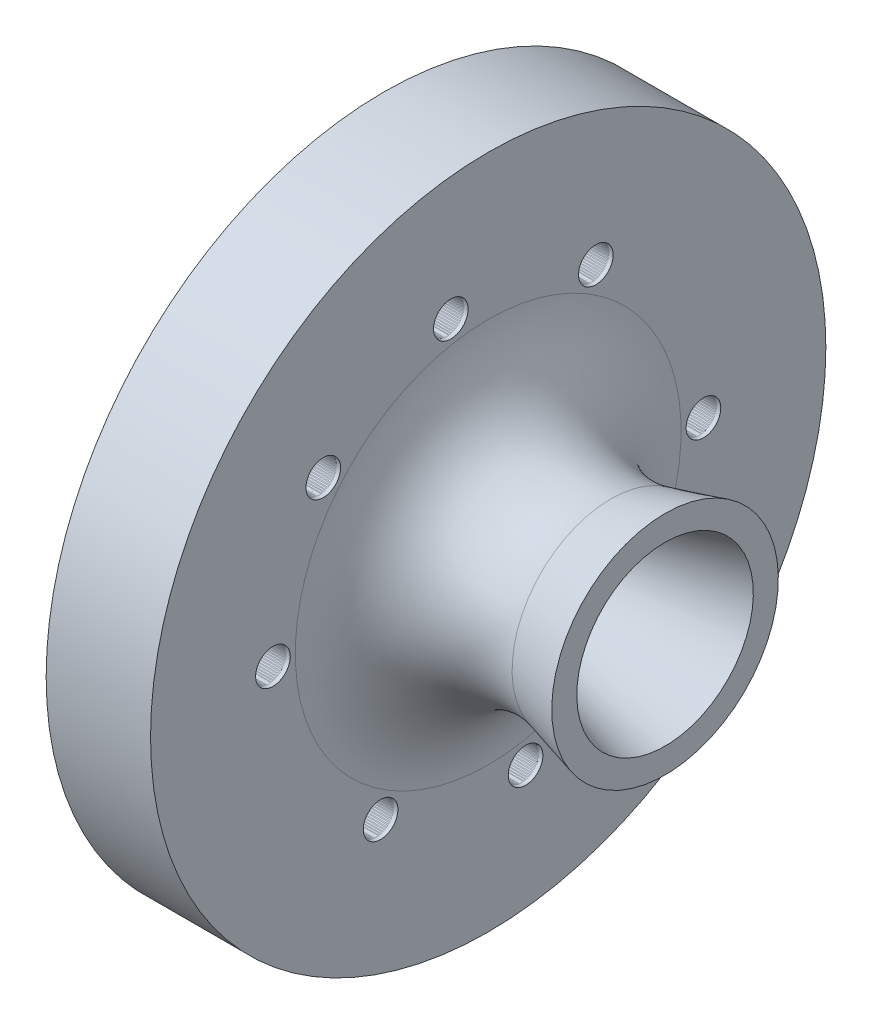
from build123d import *

# Parameters (mm, degrees)
SKETCH3_R           = 23.622
SKETCH3_R_2         = 10.6172
BOSS_EXTRUDE1_DEPTH = 4
CUT_EXTRUDE1_START  = -4.3942
SKETCH10_R          = 1.635
CUT_EXTRUDE1_DEPTH  = 9.8552
FILLET2_R           = 9.2
CUT_EXTRUDE2_DEPTH  = 1.27


with BuildPart() as part:
    # Sketch2 → Revolve1 (revolve)
    with BuildSketch(Plane.XY):
        Polygon((-4.3942, 4.3942), (0, 0), (16.696, 4.4732), (16.696, 6.8354), (0, 2.3622), (0, 28.0154), (-9.8552, 28.0154), (-9.8552, 11.9792), (-7.5692, 11.9792), (-7.5692, 10.7492), (-4.3942, 10.7492), (-4.3942, 8.8892), (-5.6896, 8.8892), (-5.6896, 6.7556), (-4.3942, 6.7564), align=None)
    revolve(axis=Axis((16.696, -3.8608, 0), (-1, 0, 0)))


with BuildPart() as body_2:
    # Sketch3 → Boss-Extrude1 (new body)
    with BuildSketch(Plane.ZY.offset(4.3942)):
        with Locations(Location((0, -3.8608, 0), (0, 0, 270))):
            Circle(SKETCH3_R)
        with Locations(Location((0, -3.8608, 0), (0, 0, 270))):
            Circle(SKETCH3_R_2, mode=Mode.SUBTRACT)
    extrude(amount=-BOSS_EXTRUDE1_DEPTH)


with BuildPart() as cut_extrude1_tool:
    # Sketch10 → Cut-Extrude1 (new body)
    with BuildSketch(Plane.ZY.offset(4.3942).offset(CUT_EXTRUDE1_START)):
        with Locations(Location((-10.16, 13.7392, 0), (0, 0, 270))):
            Circle(SKETCH10_R)
        with Locations(Location((3.53, 16.1492, 0), (0, 0, 270))):
            Circle(SKETCH10_R)
        with Locations(Location((20.32, -3.8608, 0), (0, 0, 270))):
            Circle(SKETCH10_R)
        with Locations(Location((10.16, -21.4608, 0), (0, 0, 270))):
            Circle(SKETCH10_R)
        with Locations(Location((-3.53, -23.8708, 0), (0, 0, 270))):
            Circle(SKETCH10_R)
        with Locations(Location((-15.57, -16.9208, 0), (0, 0, 270))):
            Circle(SKETCH10_R)
        with Locations(Location((-20.32, -3.8608, 0), (0, 0, 270))):
            Circle(SKETCH10_R)
        with Locations(Location((15.57, 9.1992, 0), (0, 0, 270))):
            Circle(SKETCH10_R)
    extrude(amount=CUT_EXTRUDE1_DEPTH)


with BuildPart() as part_1:
    add(part.part)

    # Cut-Extrude1: cut by cut_extrude1_tool
    add(cut_extrude1_tool.part, mode=Mode.SUBTRACT)

    # Fillet2
    fillet2_edges = [part_1.edges().sort_by_distance(p)[0] for p in [
        (0, -10.0838, 0),
    ]]
    fillet(fillet2_edges, radius=FILLET2_R)

    # Sketch11 → Cut-Extrude2 (cut)
    with BuildSketch(Plane.ZY.offset(9.8552)):
        Polygon((-14.034003032, 7.028328606), (-16.233412123, 3.218328606), (-19.533079697, 5.123136706), (-17.333670606, 8.933136706), align=None)
    extrude(amount=-CUT_EXTRUDE2_DEPTH, mode=Mode.SUBTRACT)


with BuildPart() as body_2_1:
    add(body_2.part)

    # Cut-Extrude1: cut by cut_extrude1_tool
    add(cut_extrude1_tool.part, mode=Mode.SUBTRACT)


solid = Compound([part_1.part, body_2_1.part])
